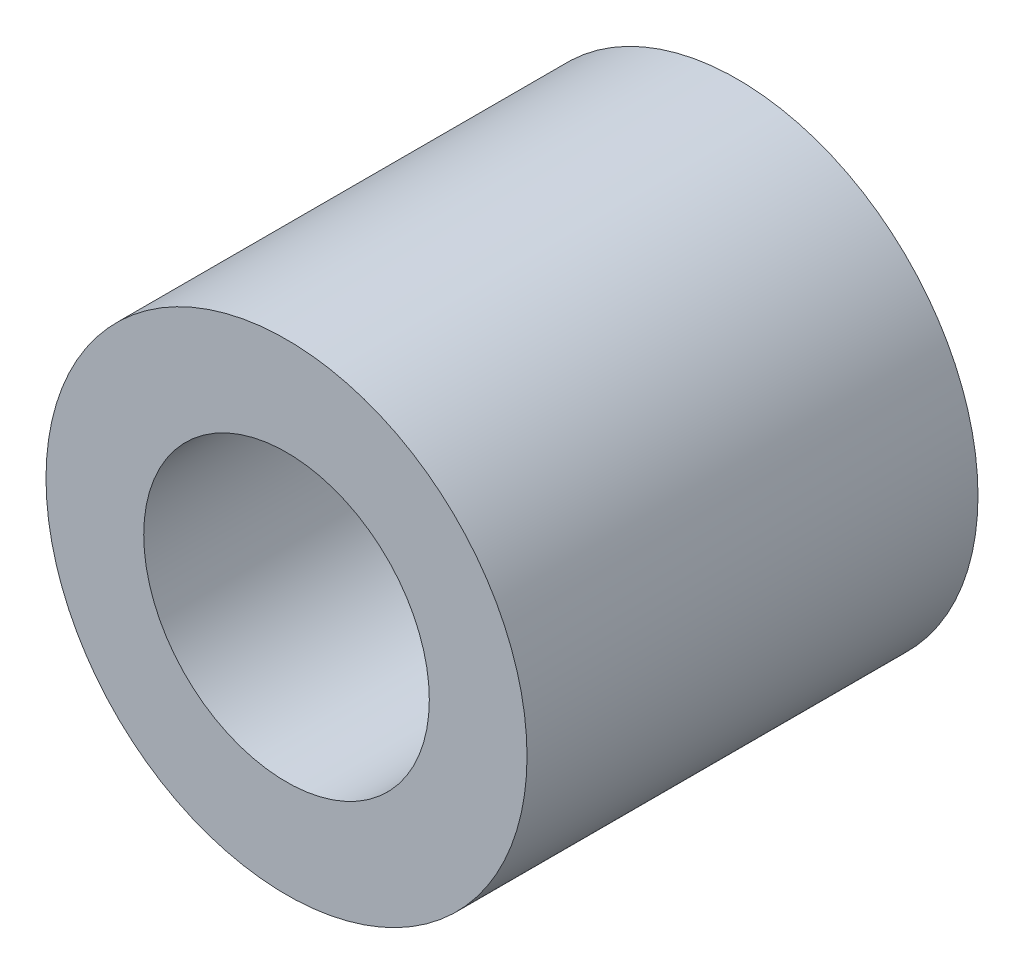
from build123d import *

# Parameters (mm, degrees)
SKETCH1_R           = 8
SKETCH1_R_2         = 4.75
BOSS_EXTRUDE1_DEPTH = 15


with BuildPart() as part:
    # Sketch1 → Boss-Extrude1 (new body)
    with BuildSketch(Plane.XY):
        Circle(SKETCH1_R)
        Circle(SKETCH1_R_2, mode=Mode.SUBTRACT)
    extrude(amount=-BOSS_EXTRUDE1_DEPTH)


solid = part.part
